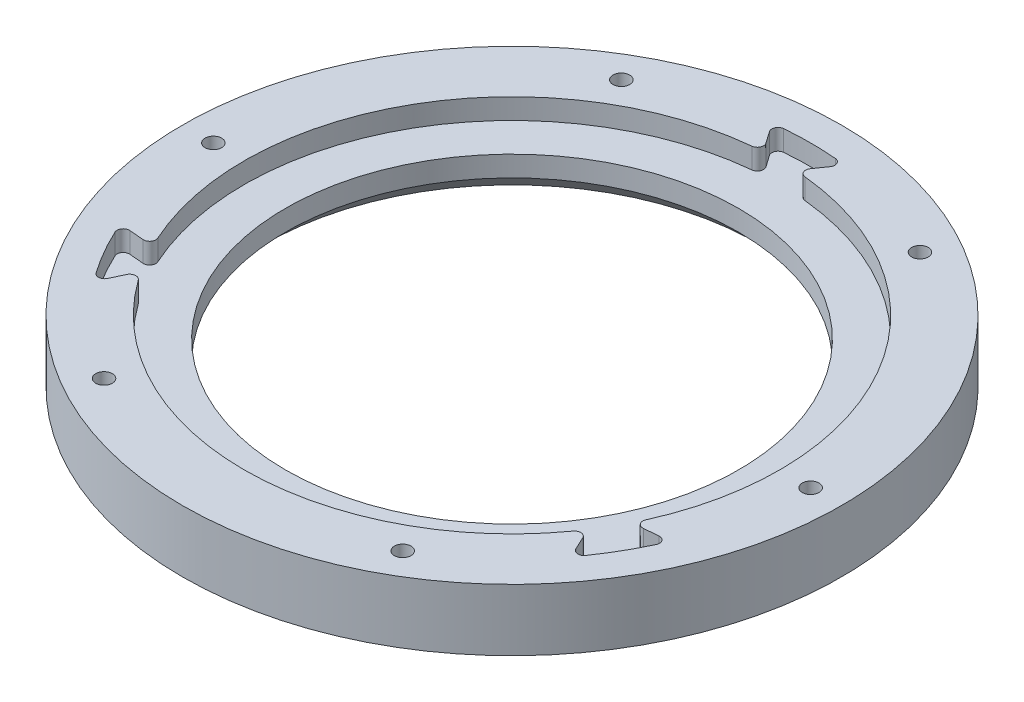
from build123d import *

# Parameters (mm, degrees)
CUT_EXTRUDE1_START       = -5
CUT_EXTRUDE1_DEPTH       = 5
FILLET1_R                = 1.5
CHAMFER1_SIZE            = 5
CIRPATTERN2_COUNT        = 3
FILLET1_OF_CIRPATTERN2_R = 1.5
CIRPATTERN3_COUNT        = 6


with BuildPart() as part:
    # Sketch2 → Revolve1 (revolve)
    with BuildSketch(Plane(origin=(0, 0, 0), x_dir=(0, 0, -1), z_dir=(1, 0, 0)), mode=Mode.PRIVATE) as revolve1_sk:
        Polygon((-55, 0), (-80, 0), (-80, 15), (-65, 15), (-65, 10), (-55, 10), align=None)
    revolve(revolve1_sk.sketch.rotate(Axis((0, -0.75, 0), (0, 1, 0)), 180), axis=Axis((0, -0.75, 0), (0, 1, 0)))

    # Sketch4 → Cut-Extrude1 (cut)
    with BuildSketch(Plane(origin=(0, 15, 0), x_dir=(1, 0, 0), z_dir=(0, 1, 0)).offset(CUT_EXTRUDE1_START)):
        with BuildLine():
            Line((-3.881158746, 64.88402428), (-8.835527397, 71.959595994))
            ThreePointArc((-8.835527397, 71.959595994), (0, 72.5), (8.835527397, 71.959595994))
            Line((8.835527397, 71.959595994), (3.881158746, 64.88402428))
            ThreePointArc((3.881158746, 64.88402428), (0, 65), (-3.881158746, 64.88402428))
        make_face()
    cut_extrude1 = extrude(amount=CUT_EXTRUDE1_DEPTH, mode=Mode.SUBTRACT)

    # Fillet1
    fillet1_edges = [part.edges().sort_by_distance(p)[0] for p in [
        (3.881158746, 12.5, -64.88402428),
        (-3.881158746, 12.5, -64.88402428),
        (-8.835527397, 12.5, -71.959595994),
        (8.835527397, 12.5, -71.959595994),
    ]]
    fillet(fillet1_edges, radius=FILLET1_R)

    # Chamfer1
    chamfer1_edges = [part.edges().sort_by_distance(p)[0] for p in [
        (0, 0, 55),
    ]]
    chamfer(chamfer1_edges, length=CHAMFER1_SIZE)

    # CirPattern2: Cut-Extrude1 ×3 about axis
    cirpattern2_axis = Axis((0, 0, 0), (0, 1, 0))
    for i in range(1, CIRPATTERN2_COUNT):
        add(cut_extrude1.rotate(cirpattern2_axis, i * 360 / CIRPATTERN2_COUNT), mode=Mode.SUBTRACT)

    # Fillet1 of CirPattern2
    fillet1_of_cirpattern2_edges = [part.edges().sort_by_distance(p)[0] for p in [
        (-58.131792699, 12.5, 29.08083007),
        (-54.250633954, 12.5, 35.80319421),
        (-57.901074478, 12.5, 43.631589179),
        (-66.736601875, 12.5, 28.328006815),
        (54.250633954, 12.5, 35.80319421),
        (58.131792699, 12.5, 29.08083007),
        (66.736601875, 12.5, 28.328006815),
        (57.901074478, 12.5, 43.631589179),
    ]]
    fillet(fillet1_of_cirpattern2_edges, radius=FILLET1_OF_CIRPATTERN2_R)

    # Sketch7 → #10-32 Tapped Hole1 (revolve, cut)
    with BuildSketch(Plane(origin=(-36.25, 15, -62.786841774), x_dir=(0, 0, 1), z_dir=(1, 0, 0))):
        Polygon((0, 0), (0, 11.213317848), (2.0193, 10), (2.0193, 0), align=None)
    f_10_32_tapped_hole1 = revolve(axis=Axis((-36.25, 21.35, -62.786841774), (0, -1, 0)), mode=Mode.SUBTRACT)

    # CirPattern3: #10-32 Tapped Hole1 ×6 about axis
    cirpattern3_axis = Axis((0, 0, 0), (0, 1, 0))
    for i in range(1, CIRPATTERN3_COUNT):
        add(f_10_32_tapped_hole1.rotate(cirpattern3_axis, i * 360 / CIRPATTERN3_COUNT), mode=Mode.SUBTRACT)


solid = part.part
